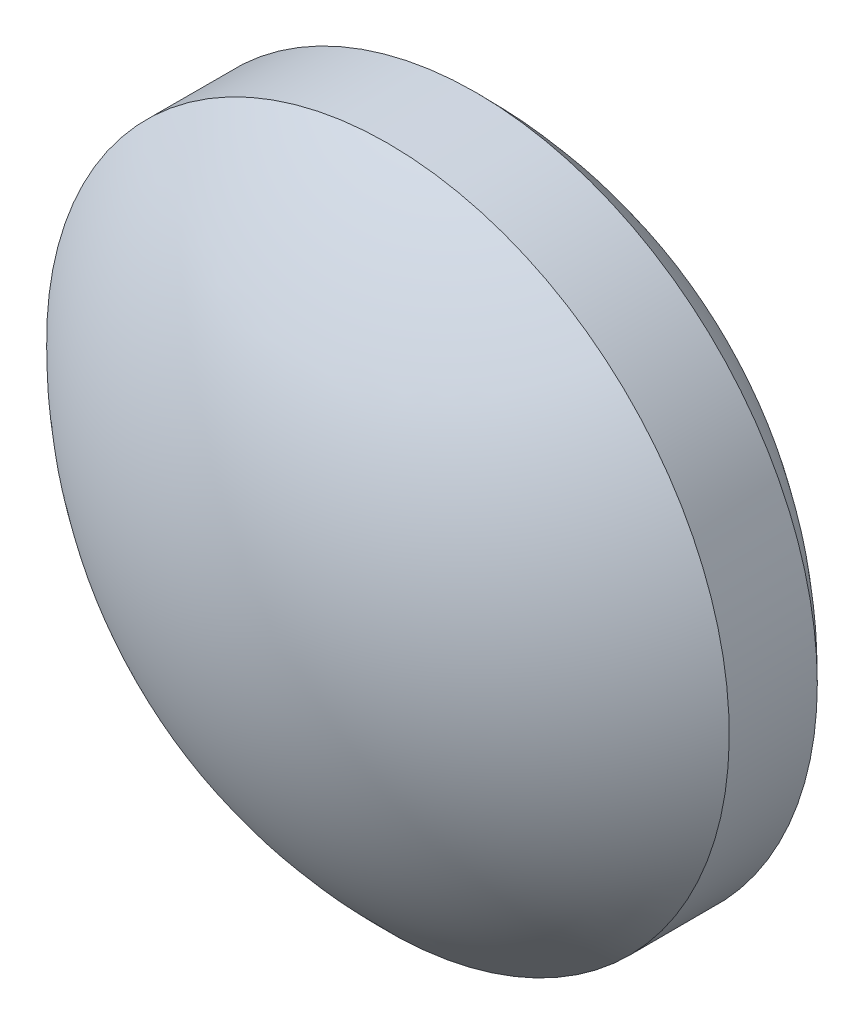
from build123d import *


with BuildPart() as part:
    # Sketch3 → Revolve1 (revolve)
    with BuildSketch(Plane(origin=(0, 0, 0), x_dir=(0, 0, -1), z_dir=(1, 0, 0))):
        with BuildLine():
            Line((0, 3.875), (0, 0))
            Line((0, 0), (2.139099177, 0))
            ThreePointArc((2.139099177, 0), (1.712471496, 2.103703348), (0.5, 3.875))
            Line((0.5, 3.875), (0, 3.875))
        make_face()
        with BuildLine():
            ThreePointArc((-0.5, 3.875), (-1.712471496, 2.103703348), (-2.139099177, 0))
            Line((-2.139099177, 0), (0, 0))
            Line((0, 0), (0, 3.875))
            Line((0, 3.875), (-0.5, 3.875))
        make_face()
    revolve(axis=Axis((0, 0, 0), (0, 0, 1)))


solid = part.part
